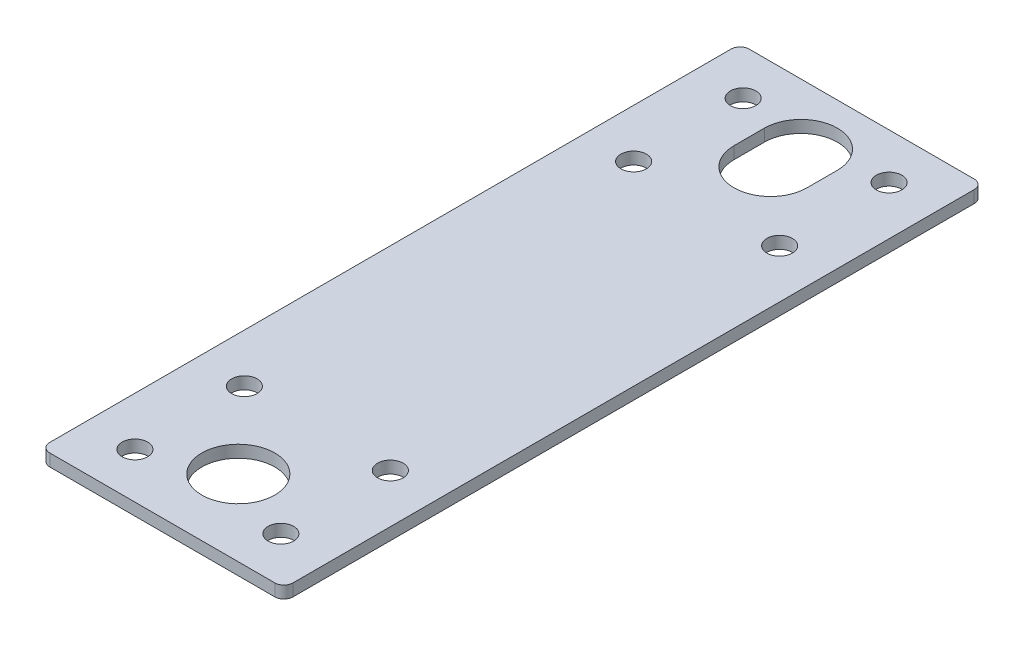
from build123d import *

# Parameters (mm, degrees)
SKETCH1_W           = 40
SKETCH1_H           = 115
SKETCH1_R           = 6
BOSS_EXTRUDE1_DEPTH = 2
SKETCH2_R           = 2.1
CUT_EXTRUDE1_DEPTH  = 84.127913483
CUT_EXTRUDE2_DEPTH  = 84.127913483
FILLET1_R           = 1.5


with BuildPart() as part:
    # Sketch1 → Boss-Extrude1 (new body)
    with BuildSketch(Plane(origin=(0, 0, 0), x_dir=(1, 0, 0), z_dir=(0, 1, 0))):
        with Locations((-40, 0)):
            Rectangle(SKETCH1_W, SKETCH1_H)
        with Locations(Location((-40, -45, 0), (0, 0, 270))):
            Circle(SKETCH1_R, mode=Mode.SUBTRACT)
        with Locations(Location((-40, 45, 0), (0, 0, 270))):
            Circle(SKETCH1_R, mode=Mode.SUBTRACT)
    extrude(amount=BOSS_EXTRUDE1_DEPTH)

    # Sketch2 → Cut-Extrude1 (cut, through all)
    with BuildSketch(Plane(origin=(0, 2, 0), x_dir=(1, 0, 0), z_dir=(0, 1, 0))):
        with Locations(Location((-52, -32, 0), (0, 0, 270))):
            Circle(SKETCH2_R)
        with Locations(Location((-28, -32, 0), (0, 0, 90))):
            Circle(SKETCH2_R)
        with Locations(Location((-28, -50, 0), (0, 0, 270))):
            Circle(SKETCH2_R)
        with Locations(Location((-52, -50, 0), (0, 0, 90))):
            Circle(SKETCH2_R)
        with Locations(Location((-28, 50, 0), (0, 0, 90))):
            Circle(SKETCH2_R)
        with Locations(Location((-52, 50, 0), (0, 0, 270))):
            Circle(SKETCH2_R)
        with Locations(Location((-52, 32, 0), (0, 0, 90))):
            Circle(SKETCH2_R)
        with Locations(Location((-28, 32, 0), (0, 0, 270))):
            Circle(SKETCH2_R)
    extrude(amount=-CUT_EXTRUDE1_DEPTH, mode=Mode.SUBTRACT)

    # Sketch3 → Cut-Extrude2 (cut, through all)
    with BuildSketch(Plane(origin=(0, 2, 0), x_dir=(1, 0, 0), z_dir=(0, 1, 0))):
        with BuildLine():
            Line((-34, 47.5), (-34, 42.5))
            ThreePointArc((-34, 42.5), (-40, 36.5), (-46, 42.5))
            Line((-46, 42.5), (-46, 47.5))
            ThreePointArc((-46, 47.5), (-40, 53.5), (-34, 47.5))
        make_face()
    extrude(amount=-CUT_EXTRUDE2_DEPTH, mode=Mode.SUBTRACT)

    # Fillet1
    fillet1_edges = [part.edges().sort_by_distance(p)[0] for p in [
        (-20, 1, 57.5),
        (-60, 1, 57.5),
        (-60, 1, -57.5),
        (-20, 1, -57.5),
    ]]
    fillet(fillet1_edges, radius=FILLET1_R)


solid = part.part
